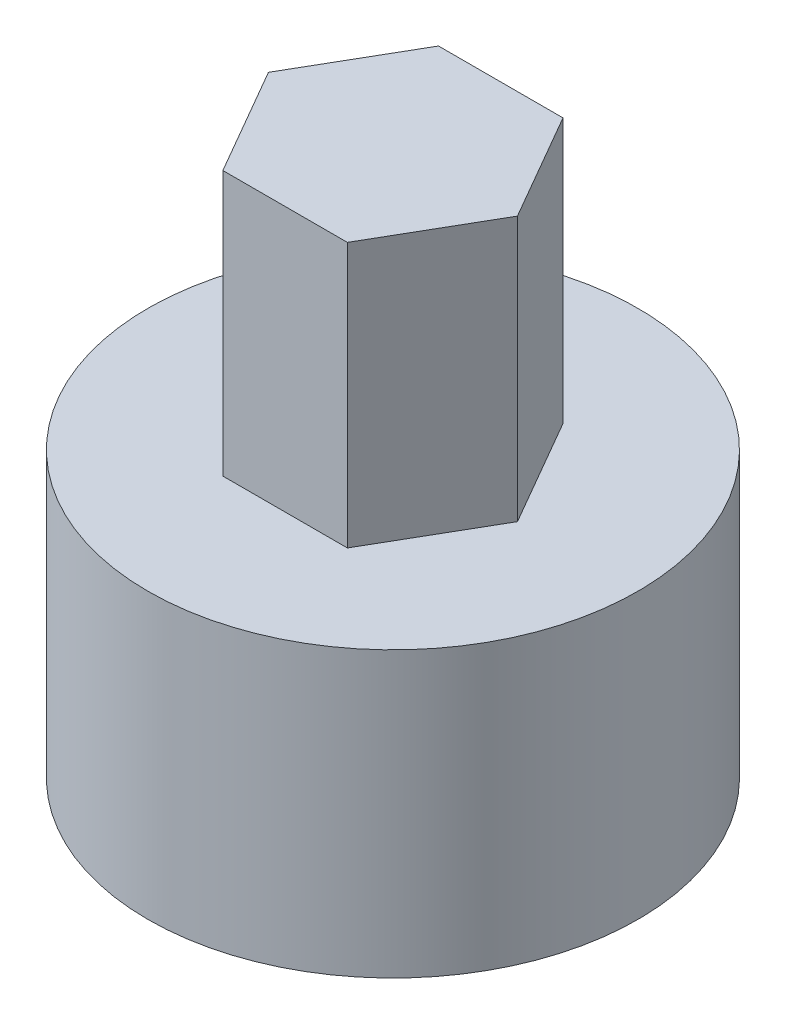
from build123d import *

# Parameters (mm, degrees)
EXTRUDE_1_DEPTH = 2.7
SKETCH_1_4_R    = 2.5
EXTRUDE_3_DEPTH = 0.9
EXTRUDE_START   = -0.9
SKETCH_1_3_R    = 2.5
SKETCH_1_3_R_2  = 1.65
EXTRUDE_2_DEPTH = 2


with BuildPart() as part:
    # 草图1 → 凸台-拉伸1 (new body)
    with BuildSketch(Plane(origin=(0, 0, 0), x_dir=(1, 0, 0), z_dir=(0, 1, 0))):
        Polygon((1.270170592, 0), (0.635085296, 1.1), (-0.635085296, 1.1), (-1.270170592, 0), (-0.635085296, -1.1), (0.635085296, -1.1), align=None)
    extrude(amount=EXTRUDE_1_DEPTH)

    # 草图1<4> → 凸台-拉伸3 (add)
    with BuildSketch(Plane(origin=(0, 0, 0), x_dir=(1, 0, 0), z_dir=(0, 1, 0))):
        with Locations(Location((0, 0, 0), (0, 0, 270))):
            Circle(SKETCH_1_4_R)
    extrude(amount=-EXTRUDE_3_DEPTH)

    # 草图1<3> → 凸台-拉伸2 (add)
    # profile 1 of 3: a face of its own
    with BuildSketch(Plane(origin=(0, 0, 0), x_dir=(1, 0, 0), z_dir=(0, 1, 0)).offset(EXTRUDE_START)):
        with Locations(Location((0, 0, 0), (0, 0, 270))):
            Circle(SKETCH_1_3_R)
        Circle(SKETCH_1_3_R_2, mode=Mode.SUBTRACT)
    # profile 2 of 3: a face of its own
    with BuildSketch(Plane(origin=(0, 0, 0), x_dir=(1, 0, 0), z_dir=(0, 1, 0)).offset(EXTRUDE_START)):
        with BuildLine():
            ThreePointArc((1.65, 0), (1.478597308, 0.732290926), (1, 1.312440475))
            Line((1, 1.312440475), (1, 0.467949192))
            Line((1, 0.467949192), (1.270170592, 0))
            Line((1.270170592, 0), (1, -0.467949192))
            Line((1, -0.467949192), (1, -1.312440475))
            ThreePointArc((1, -1.312440475), (1.478597308, -0.732290926), (1.65, 0))
        make_face()
    # profile 3 of 3: a face of its own
    with BuildSketch(Plane(origin=(0, 0, 0), x_dir=(1, 0, 0), z_dir=(0, 1, 0)).offset(EXTRUDE_START)):
        Polygon((1.270170592, 0), (1, 0.467949192), (1, -0.467949192), align=None)
    extrude(amount=-EXTRUDE_2_DEPTH)


solid = part.part
